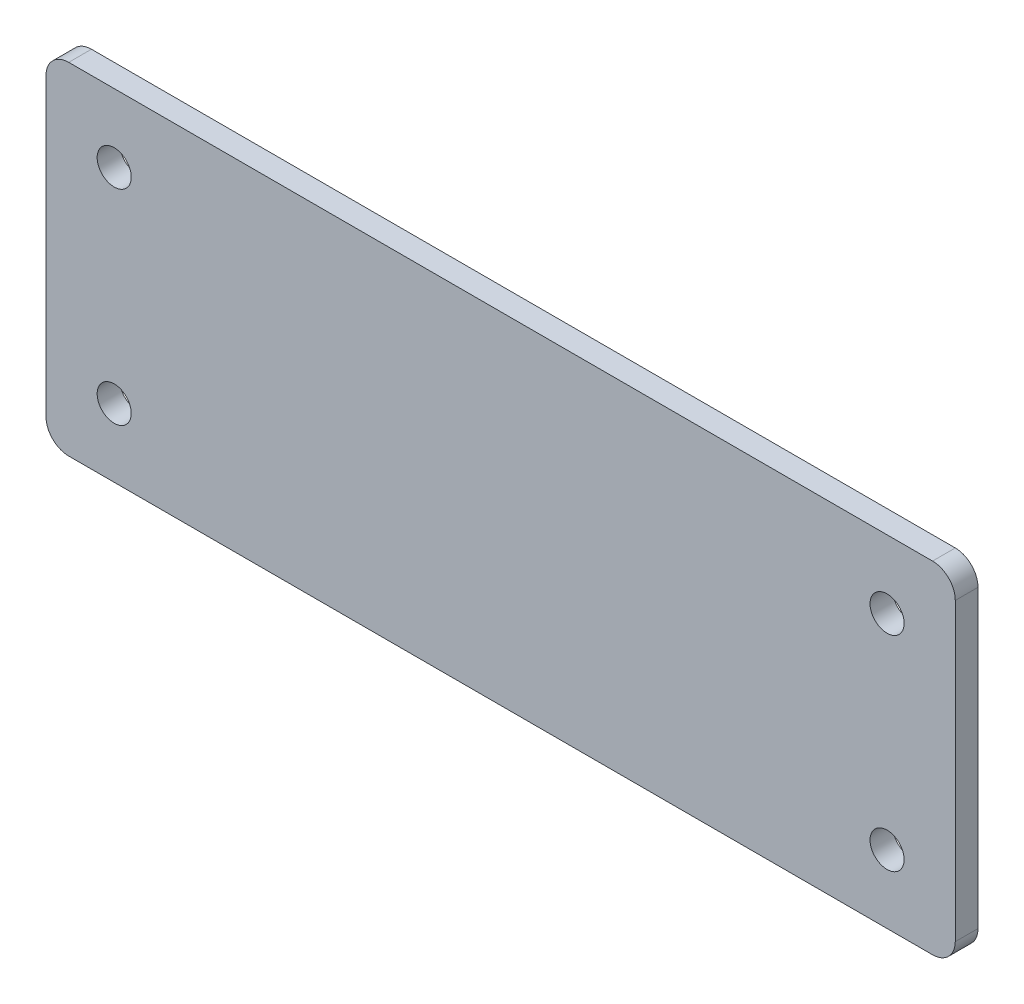
from build123d import *

# Parameters (mm, degrees)
SKETCH_1_W          = 400
SKETCH_1_H          = 150
EXTRUDE_1_DEPTH     = 5
SKETCH_2_R          = 7.5
CUT_EXTRUDE_1_DEPTH = 214.834047803
FILLET_1_R          = 10


with BuildPart() as part:
    # Эскиз1 → Бобышка-Вытянуть1 (new, symmetric)
    with BuildSketch(Plane.XY):
        Rectangle(SKETCH_1_W, SKETCH_1_H)
    extrude(amount=EXTRUDE_1_DEPTH, both=True)

    # Эскиз2 → Вырез-Вытянуть1 (cut, through all)
    with BuildSketch(Plane.XY.offset(5)):
        with Locations((-170, 45)):
            Circle(SKETCH_2_R)
        with Locations(Location((-170, -45, 0), (0, 0, 180))):
            Circle(SKETCH_2_R)
        with Locations((170, -45)):
            Circle(SKETCH_2_R)
        with Locations(Location((170, 45, 0), (0, 0, 180))):
            Circle(SKETCH_2_R)
    extrude(amount=-CUT_EXTRUDE_1_DEPTH, mode=Mode.SUBTRACT)

    # Скругление1
    fillet_1_edges = [part.edges().sort_by_distance(p)[0] for p in [
        (200, -75, 0),
        (-200, -75, 0),
        (-200, 75, 0),
        (200, 75, 0),
    ]]
    fillet(fillet_1_edges, radius=FILLET_1_R)


solid = part.part
